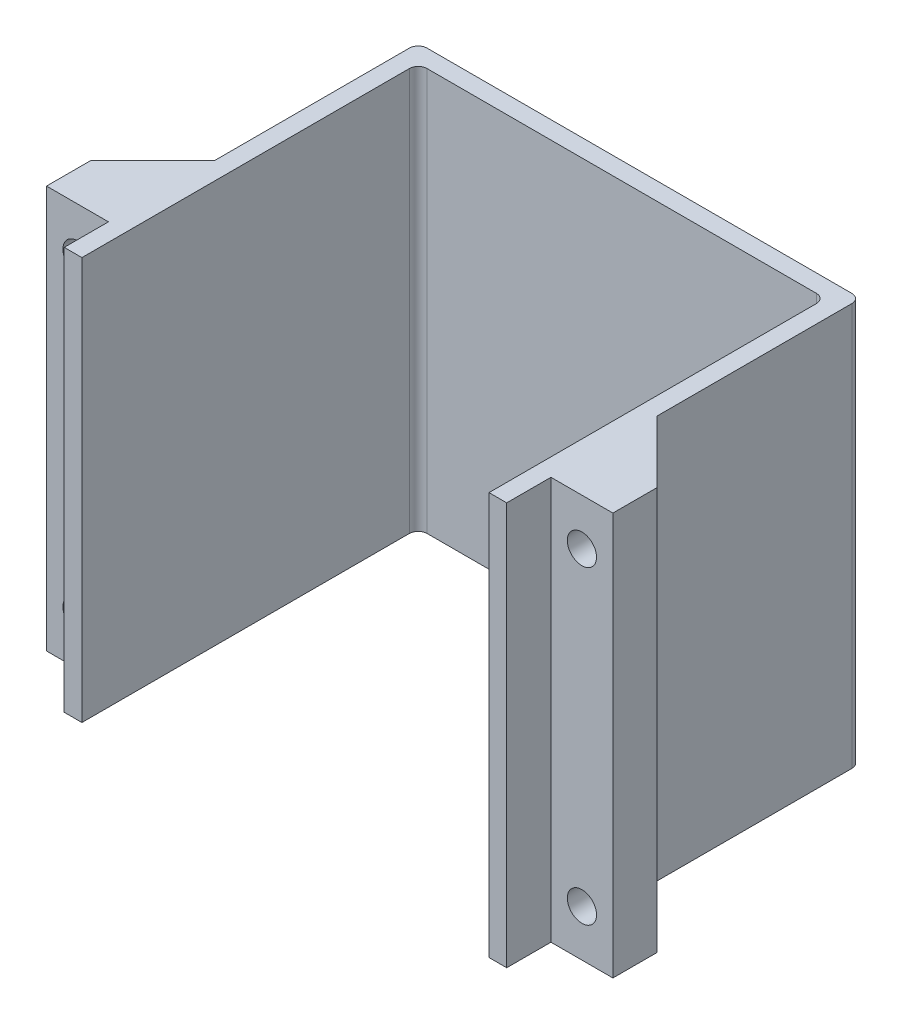
from build123d import *

# Parameters (mm, degrees)
SKETCH_1_W          = 64
SKETCH_1_H          = 40
EXTRUDE_1_DEPTH     = 45.5
CUT_EXTRUDE_1_REACH = 61.112
SKETCH_2_W          = 46
SKETCH_2_H          = 38
CUT_EXTRUDE_2_REACH = 61.112
SKETCH_3_W          = 7
SKETCH_3_H          = 30
EXTRUDE_2_DEPTH     = 45.5
CUT_EXTRUDE_3_REACH = 70.515
SKETCH_4_R          = 1.65
SKETCH_7_R          = 3
CUT_EXTRUDE_4_DEPTH = 30
SKETCH_8_W          = 7
SKETCH_8_H          = 45.5
CUT_EXTRUDE_5_DEPTH = 5
FILLET_1_R          = 1


with BuildPart() as part:
    # 草图1 → 凸台-拉伸1 (new body)
    with BuildSketch(Plane(origin=(0, 0, 0), x_dir=(1, 0, 0), z_dir=(0, 1, 0))):
        Rectangle(SKETCH_1_W, SKETCH_1_H)
    extrude(amount=EXTRUDE_1_DEPTH)

    # 草图2 → 切除-拉伸1 (cut, up to next)
    with BuildSketch(Plane(origin=(0, 45.5, 0), x_dir=(1, 0, 0), z_dir=(0, 1, 0)), mode=Mode.PRIVATE) as cut_extrude_1_sk1:
        with Locations((0, -1)):
            Rectangle(SKETCH_2_W, SKETCH_2_H)
    cut_extrude_1_tool1 = extrude(cut_extrude_1_sk1.sketch, amount=-CUT_EXTRUDE_1_REACH, mode=Mode.PRIVATE) & part.part
    add(cut_extrude_1_tool1.solids().sort_by_distance((0, 45.5, 1))[0], mode=Mode.SUBTRACT)

    # 草图3 → 切除-拉伸2 (cut, up to next)
    with BuildSketch(Plane(origin=(0, 45.5, 0), x_dir=(1, 0, 0), z_dir=(0, 1, 0)), mode=Mode.PRIVATE) as cut_extrude_2_sk1:
        with Locations((-28.5, 5)):
            Rectangle(SKETCH_3_W, SKETCH_3_H)
    cut_extrude_2_tool1 = extrude(cut_extrude_2_sk1.sketch, amount=-CUT_EXTRUDE_2_REACH, mode=Mode.PRIVATE) & part.part
    cut_extrude_2 = cut_extrude_2_tool1.solids().sort_by_distance((-28.5, 45.5, -5))[0]
    add(cut_extrude_2, mode=Mode.SUBTRACT)

    # 草图6 → 凸台-拉伸2 (add)
    with BuildSketch(Plane(origin=(0, 0, 0), x_dir=(1, 0, 0), z_dir=(0, 1, 0))):
        Polygon((-32, -10), (-25, -10), (-25, -3), align=None)
    extrude_2 = extrude(amount=EXTRUDE_2_DEPTH)

    # 切除-拉伸3: up to this plane
    cut_extrude_3_end = Plane(origin=(-25, 55.399494937, 3), z_dir=(0.7071067811865438, 0, 0.7071067811865512))
    # 草图4 → 切除-拉伸3 (cut, up to the surface)
    with BuildSketch(Plane(origin=(0, 0, 20), x_dir=(-1, 0, 0), z_dir=(0, 0, -1)), mode=Mode.PRIVATE) as cut_extrude_3_sk1:
        with Locations((28.5, 40.25)):
            Circle(SKETCH_4_R)
    cut_extrude_3_tool1 = split(extrude(cut_extrude_3_sk1.sketch, amount=CUT_EXTRUDE_3_REACH, mode=Mode.PRIVATE), bisect_by=cut_extrude_3_end, keep=Keep.BOTH, mode=Mode.PRIVATE)
    # 草图4 → 切除-拉伸3 (cut, up to the surface)
    with BuildSketch(Plane(origin=(0, 0, 20), x_dir=(-1, 0, 0), z_dir=(0, 0, -1)), mode=Mode.PRIVATE) as cut_extrude_3_sk2:
        with Locations((28.5, 5.25)):
            Circle(SKETCH_4_R)
    cut_extrude_3_tool2 = split(extrude(cut_extrude_3_sk2.sketch, amount=CUT_EXTRUDE_3_REACH, mode=Mode.PRIVATE), bisect_by=cut_extrude_3_end, keep=Keep.BOTH, mode=Mode.PRIVATE)
    cut_extrude_3 = cut_extrude_3_tool1.solids().sort_by_distance((-28.5, 40.25, 20))[0] + cut_extrude_3_tool2.solids().sort_by_distance((-28.5, 5.25, 20))[0]
    add(cut_extrude_3, mode=Mode.SUBTRACT)

    # 草图7 → 切除-拉伸4 (cut)
    with BuildSketch(Plane(origin=(0, 0, -20), x_dir=(-1, 0, 0), z_dir=(0, 0, -1))):
        with Locations((28.5, 40.25)):
            Circle(SKETCH_7_R)
        with Locations((28.5, 5.25)):
            Circle(SKETCH_7_R)
    cut_extrude_4 = extrude(amount=-CUT_EXTRUDE_4_DEPTH, mode=Mode.SUBTRACT)

    # 草图8 → 切除-拉伸5 (cut)
    with BuildSketch(Plane.XY.offset(20)):
        with Locations((-28.5, 22.75)):
            Rectangle(SKETCH_8_W, SKETCH_8_H)
    cut_extrude_5 = extrude(amount=-CUT_EXTRUDE_5_DEPTH, mode=Mode.SUBTRACT)

    # 镜向1: 切除-拉伸2, 凸台-拉伸2, 切除-拉伸3, 切除-拉伸4, 切除-拉伸5 across plane
    add(cut_extrude_2.mirror(Plane(origin=(0, 0, 0), x_dir=(0, 0, 1), z_dir=(1, 0, 0))), mode=Mode.SUBTRACT)
    add(extrude_2.mirror(Plane(origin=(0, 0, 0), x_dir=(0, 0, 1), z_dir=(1, 0, 0))))
    add(cut_extrude_3.mirror(Plane(origin=(0, 0, 0), x_dir=(0, 0, 1), z_dir=(1, 0, 0))), mode=Mode.SUBTRACT)
    add(cut_extrude_4.mirror(Plane(origin=(0, 0, 0), x_dir=(0, 0, 1), z_dir=(1, 0, 0))), mode=Mode.SUBTRACT)
    add(cut_extrude_5.mirror(Plane(origin=(0, 0, 0), x_dir=(0, 0, 1), z_dir=(1, 0, 0))), mode=Mode.SUBTRACT)

    # 圆角1
    fillet_1_edges = [part.edges().sort_by_distance(p)[0] for p in [
        (-23, 22.75, -18),
        (23, 22.75, -18),
        (-25, 22.75, -20),
        (25, 22.75, -20),
    ]]
    fillet(fillet_1_edges, radius=FILLET_1_R)


solid = part.part
